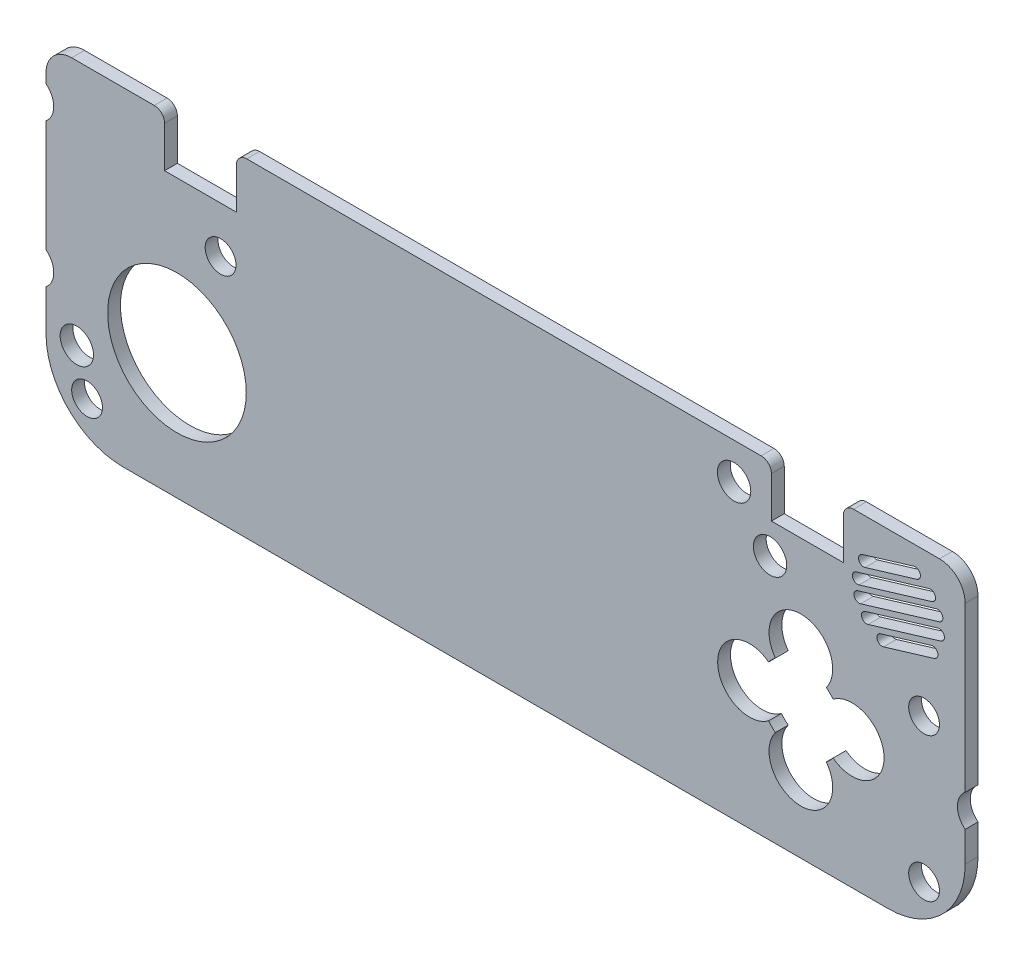
from build123d import *

# Parameters (mm, degrees)
BOSS_EXTRU_1_DEPTH       = 2.5
JOYSTICK_R               = 13.5
ENL_V_MAT_EXTRU_2_DEPTH  = 2.5
ESQUISSE2_W              = 14
ESQUISSE2_H              = 10
ENL_V_MAT_EXTRU_3_DEPTH  = 10
CONG_1_R                 = 2
CONG_2_R                 = 2
ESQUISSE3_W              = 14
ESQUISSE3_H              = 10
ENL_V_MAT_EXTRU_4_DEPTH  = 10
CONG_3_R                 = 2
CONG_4_R                 = 2
F_12X12_BUTTON_R         = 6.2
ENL_V_MAT_EXTRU_5_DEPTH  = 10
ENL_V_MAT_EXTRU_8_DEPTH  = 10
ESQUISSE5_R              = 3
ESQUISSE5_R_2            = 3.25
ENL_V_MAT_EXTRU_9_DEPTH  = 10
ESQUISSE6_R              = 4
ENL_V_MAT_EXTRU_11_DEPTH = 10


with BuildPart() as part:
    # Esquisse1 → Boss.-Extru.1 (new body)
    with BuildSketch(Plane.XY):
        with BuildLine():
            Line((-89.203921136, 33.34478673), (79.796078864, 33.34478673))
            ThreePointArc((79.796078864, 33.34478673), (83.33161277, 31.880320636), (84.796078864, 28.34478673))
            Line((84.796078864, 28.34478673), (84.796078864, -15.65521327))
            ThreePointArc((84.796078864, -15.65521327), (80.402680581, -26.261814988), (69.796078864, -30.65521327))
            Line((69.796078864, -30.65521327), (-79.203921136, -30.65521327))
            ThreePointArc((-79.203921136, -30.65521327), (-89.810522854, -26.261814988), (-94.203921136, -15.65521327))
            Line((-94.203921136, -15.65521327), (-94.203921136, 28.34478673))
            ThreePointArc((-94.203921136, 28.34478673), (-92.739455042, 31.880320636), (-89.203921136, 33.34478673))
        make_face()
    extrude(amount=BOSS_EXTRU_1_DEPTH)

    # Joystick → Enlèv. mat.-Extru.2 (cut)
    with BuildSketch(Plane.XY.offset(2.5)):
        with Locations((-68.703921136, -6.15521327)):
            Circle(JOYSTICK_R)
    extrude(amount=-ENL_V_MAT_EXTRU_2_DEPTH, mode=Mode.SUBTRACT)

    # Esquisse2 → Enlèv. mat.-Extru.3 (cut)
    with BuildSketch(Plane.XY.offset(2.5)):
        with Locations((54.066078864, 28.34478673)):
            Rectangle(ESQUISSE2_W, ESQUISSE2_H)
    extrude(amount=-ENL_V_MAT_EXTRU_3_DEPTH, mode=Mode.SUBTRACT)

    # Congé1
    cong_1_edges = [part.edges().sort_by_distance(p)[0] for p in [
        (47.066078864, 33.34478673, 1.25),
    ]]
    fillet(cong_1_edges, radius=CONG_1_R)

    # Congé2
    cong_2_edges = [part.edges().sort_by_distance(p)[0] for p in [
        (61.066078864, 33.34478673, 1.25),
    ]]
    fillet(cong_2_edges, radius=CONG_2_R)

    # Esquisse3 → Enlèv. mat.-Extru.4 (cut)
    with BuildSketch(Plane.XY.offset(2.5)):
        with Locations((-64.113921136, 28.34478673)):
            Rectangle(ESQUISSE3_W, ESQUISSE3_H)
    extrude(amount=-ENL_V_MAT_EXTRU_4_DEPTH, mode=Mode.SUBTRACT)

    # Congé3
    cong_3_edges = [part.edges().sort_by_distance(p)[0] for p in [
        (-71.113921136, 33.34478673, 1.25),
    ]]
    fillet(cong_3_edges, radius=CONG_3_R)

    # Congé4
    cong_4_edges = [part.edges().sort_by_distance(p)[0] for p in [
        (-57.113921136, 33.34478673, 1.25),
    ]]
    fillet(cong_4_edges, radius=CONG_4_R)

    # 12x12 Button → Enlèv. mat.-Extru.5 (cut)
    with BuildSketch(Plane.XY.offset(2.5)):
        with BuildLine():
            ThreePointArc((46.518078864, -0.6967139), (48.342086437, -2.883607238), (48.996078864, -5.65521327))
            ThreePointArc((48.996078864, -5.65521327), (48.342086437, -8.426819303), (46.518078864, -10.61371264))
            ThreePointArc((46.518078864, -10.61371264), (47.139224614, -11.31206752), (47.837579494, -11.93321327))
            ThreePointArc((47.837579494, -11.93321327), (52.796078864, -9.45521327), (57.754578233, -11.93321327))
            ThreePointArc((57.754578233, -11.93321327), (58.452933113, -11.31206752), (59.074078864, -10.61371264))
            ThreePointArc((59.074078864, -10.61371264), (56.596078864, -5.65521327), (59.074078864, -0.6967139))
            ThreePointArc((59.074078864, -0.6967139), (58.452933113, 0.001640979), (57.754578233, 0.62278673))
            ThreePointArc((57.754578233, 0.62278673), (52.796078864, -1.85521327), (47.837579494, 0.62278673))
            ThreePointArc((47.837579494, 0.62278673), (47.139224614, 0.001640979), (46.518078864, -0.6967139))
        make_face()
        with Locations((42.796078864, -5.65521327)):
            Circle(F_12X12_BUTTON_R)
        with Locations((52.796078864, 4.34478673)):
            Circle(F_12X12_BUTTON_R)
        with Locations((62.796078864, -5.65521327)):
            Circle(F_12X12_BUTTON_R)
        with Locations((52.796078864, -15.65521327)):
            Circle(F_12X12_BUTTON_R)
    extrude(amount=-ENL_V_MAT_EXTRU_5_DEPTH, mode=Mode.SUBTRACT)

    # Esquisse4 → Enlèv. mat.-Extru.8 (cut)
    with BuildSketch(Plane.XY.offset(2.5)):
        with BuildLine():
            Line((63.848163441, 19.991775112), (79.166394029, 24.612577171))
            ThreePointArc((79.166394029, 24.612577171), (80.412583569, 23.943987888), (79.743994286, 22.697798347))
            Line((79.743994286, 22.697798347), (64.425763698, 18.076996289))
            ThreePointArc((64.425763698, 18.076996289), (63.179574158, 18.745585572), (63.848163441, 19.991775112))
        make_face()
        with BuildLine():
            Line((63.539756046, 23.02230266), (77.747509179, 27.308125004))
            ThreePointArc((77.747509179, 27.308125004), (78.993698719, 26.639535721), (78.325109436, 25.39334618))
            Line((78.325109436, 25.39334618), (64.117356303, 21.107523836))
            ThreePointArc((64.117356303, 21.107523836), (62.871166763, 21.776113119), (63.539756046, 23.02230266))
        make_face()
        with BuildLine():
            Line((64.732924902, 26.557541009), (74.798428352, 29.593838105))
            ThreePointArc((74.798428352, 29.593838105), (76.044617893, 28.925248822), (75.37602861, 27.679059282))
            Line((75.37602861, 27.679059282), (65.31052516, 24.642762185))
            ThreePointArc((65.31052516, 24.642762185), (64.064335619, 25.311351468), (64.732924902, 26.557541009))
        make_face()
        with BuildLine():
            Line((65.314724126, 17.237366416), (79.467627817, 21.506643219))
            ThreePointArc((79.467627817, 21.506643219), (80.713811222, 20.838057228), (80.04522523, 19.591873823))
            Line((80.04522523, 19.591873823), (65.89232154, 15.32259702))
            ThreePointArc((65.89232154, 15.32259702), (64.646138135, 15.991183011), (65.314724126, 17.237366416))
        make_face()
        with BuildLine():
            Line((68.322797362, 14.963301678), (78.218865725, 17.948488042))
            ThreePointArc((78.218865725, 17.948488042), (79.465055266, 17.279898759), (78.796465983, 16.033709218))
            Line((78.796465983, 16.033709218), (68.900397619, 13.048522855))
            ThreePointArc((68.900397619, 13.048522855), (67.654208079, 13.717112138), (68.322797362, 14.963301678))
        make_face()
    extrude(amount=-ENL_V_MAT_EXTRU_8_DEPTH, mode=Mode.SUBTRACT)

    # Esquisse5 → Enlèv. mat.-Extru.9 (cut)
    with BuildSketch(Plane.XY.offset(2.5)):
        with Locations((76.796078864, -22.65521327)):
            Circle(ESQUISSE5_R)
        with Locations((-86.203921136, -22.65521327)):
            Circle(ESQUISSE5_R)
        with Locations((76.796078864, 5.34478673)):
            Circle(ESQUISSE5_R)
        with Locations((-60.203921136, 14.34478673)):
            Circle(ESQUISSE5_R)
        with Locations((-88.203921136, -14.65521327)):
            Circle(ESQUISSE5_R_2)
        with Locations((39.796078864, 26.34478673)):
            Circle(ESQUISSE5_R_2)
        with Locations((46.796078864, 17.34478673)):
            Circle(ESQUISSE5_R_2)
    extrude(amount=-ENL_V_MAT_EXTRU_9_DEPTH, mode=Mode.SUBTRACT)

    # Esquisse6 → Enlèv. mat.-Extru.11 (cut)
    with BuildSketch(Plane.XY.offset(2.5)):
        with Locations((-96.703921136, -4.65521327)):
            Circle(ESQUISSE6_R)
        with Locations((-96.703921136, 23.34478673)):
            Circle(ESQUISSE6_R)
        with Locations((87.296078864, -6.65521327)):
            Circle(ESQUISSE6_R)
    extrude(amount=-ENL_V_MAT_EXTRU_11_DEPTH, mode=Mode.SUBTRACT)


solid = part.part
